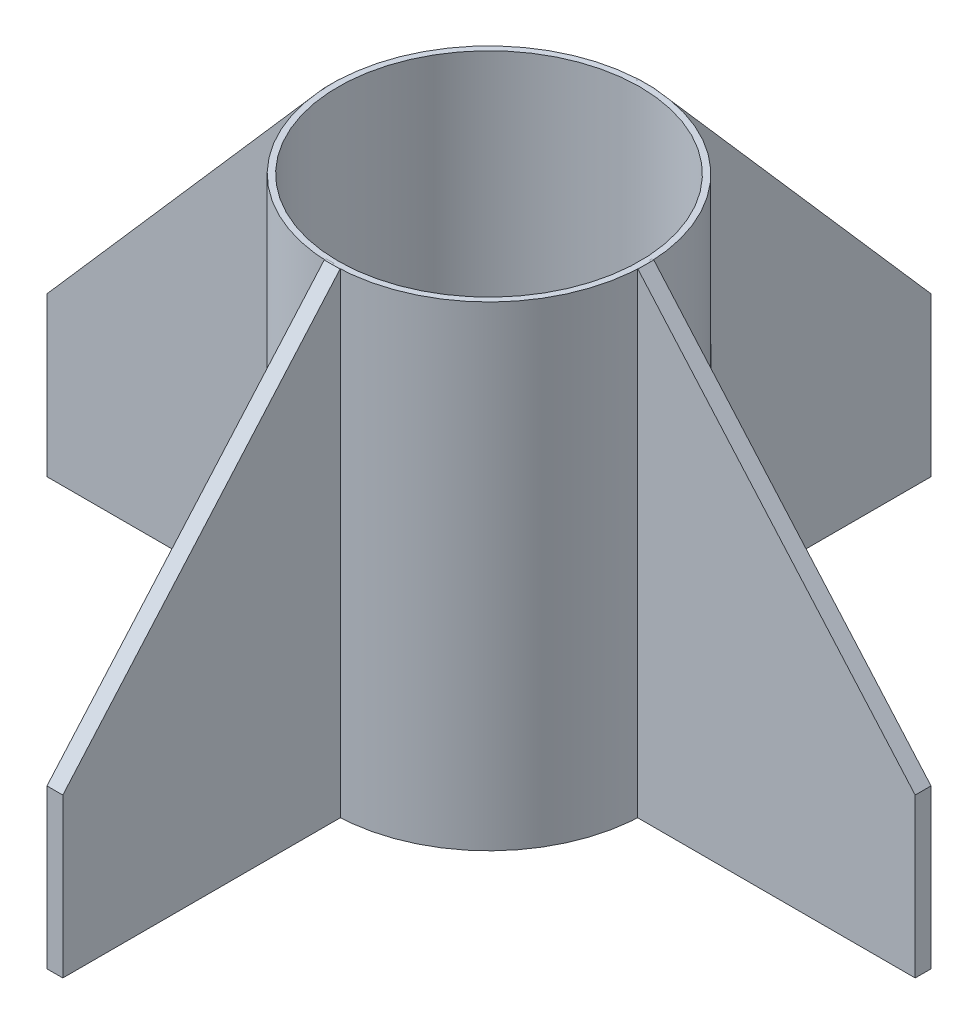
from build123d import *

# Parameters (mm, degrees)
SKETCH1_R                = 39.6
SKETCH1_R_2              = 38.1
BOSS_EXTRUDE1_DEPTH      = 120
BOSS_EXTRUDE2_DEPTH      = 2
BOSS_EXTRUDE2_DEPTH_BACK = 2
SKETCH3_W                = 4
SKETCH3_H                = 120
BOSS_EXTRUDE3_DEPTH      = 0.5
CIRPATTERN1_COUNT        = 4
CUT_EXTRUDE1_REACH       = 198.021
CUT_EXTRUDE1_END_RADIUS  = 39.6
SKETCH5_R                = 2


with BuildPart() as part:
    # Sketch1 → Boss-Extrude1 (new body)
    with BuildSketch(Plane(origin=(0, 0, 0), x_dir=(1, 0, 0), z_dir=(0, 1, 0))):
        Circle(SKETCH1_R)
        Circle(SKETCH1_R_2, mode=Mode.SUBTRACT)
    extrude(amount=BOSS_EXTRUDE1_DEPTH)

    # Cut-Extrude1: up to this cylinder (the profile starts inside it)
    cut_extrude1_end = Plane(origin=(0, 60, 0), z_dir=(0, -1, 0)) * Cylinder(CUT_EXTRUDE1_END_RADIUS, 476.242, mode=Mode.PRIVATE)
    # Sketch5 → Cut-Extrude1 (cut, up to the surface)
    with BuildSketch(Plane(origin=(0, 0, 0), x_dir=(0.7071067811865477, 0, 0.7071067811865475), z_dir=(-0.7071067811865475, 0, 0.7071067811865477)), mode=Mode.PRIVATE) as cut_extrude1_sk1:
        with Locations((0, 60)):
            Circle(SKETCH5_R)
    cut_extrude1_tool1 = extrude(cut_extrude1_sk1.sketch, amount=-CUT_EXTRUDE1_REACH, mode=Mode.PRIVATE) & cut_extrude1_end
    add(cut_extrude1_tool1.solids().sort_by_distance((0, 60, 0))[0], mode=Mode.SUBTRACT)


with BuildPart() as body_2:
    # Sketch2 → Boss-Extrude2 (new, two sides: drawn at the far end of the back side and taken through both)
    with BuildSketch(Plane.XY.offset(-BOSS_EXTRUDE2_DEPTH_BACK)):
        Polygon((39.6, 0), (39.6, 120), (109.6, 40), (109.6, 0), align=None)
    extrude(amount=BOSS_EXTRUDE2_DEPTH + BOSS_EXTRUDE2_DEPTH_BACK)

    # Sketch3 → Boss-Extrude3 (add)
    with BuildSketch(Plane.ZY.offset(-39.6)):
        with Locations((0, 60)):
            Rectangle(SKETCH3_W, SKETCH3_H)
    extrude(amount=BOSS_EXTRUDE3_DEPTH)


with BuildPart() as cirpattern1_1:
    # CirPattern1: pattern copy
    add(body_2.part.rotate(Axis((0, 120, 0), (0, -1, 0)), 1 * 360 / CIRPATTERN1_COUNT))


with BuildPart() as cirpattern1_2:
    # CirPattern1: pattern copy
    add(body_2.part.rotate(Axis((0, 120, 0), (0, -1, 0)), 2 * 360 / CIRPATTERN1_COUNT))


with BuildPart() as cirpattern1_3:
    # CirPattern1: pattern copy
    add(body_2.part.rotate(Axis((0, 120, 0), (0, -1, 0)), 3 * 360 / CIRPATTERN1_COUNT))


solid = Compound([part.part, body_2.part, cirpattern1_1.part, cirpattern1_2.part, cirpattern1_3.part])
